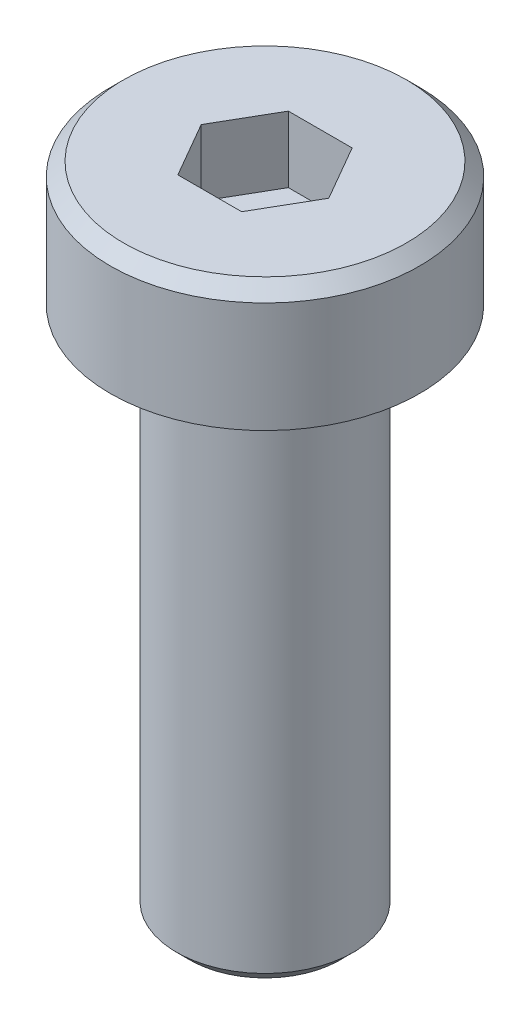
from build123d import *

# Parameters (mm, degrees)
CUT_EXTRUDE_322_DEPTH = 1.5


with BuildPart() as part:
    # Sketch 184 → Revolve 223 (revolve)
    with BuildSketch(Plane.XY, mode=Mode.PRIVATE) as revolve_223_sk:
        Polygon((0, -12), (1.7, -12), (2, -11.7), (2, 0), (3.5, 0), (3.5, 2.5), (3.2, 2.8), (0, 2.8), align=None)
    revolve(revolve_223_sk.sketch.rotate(Axis((0, -14, 0), (0, 1, 0)), 90), axis=Axis((0, -14, 0), (0, 1, 0)))

    # Sketch 274 → Cut-Extrude 322 (cut)
    with BuildSketch(Plane(origin=(0, 2.8, 0), x_dir=(1, 0, 0), z_dir=(0, 1, 0))):
        Polygon((1.443375673, 0), (0.721687836, 1.25), (-0.721687836, 1.25), (-1.443375673, 0), (-0.721687836, -1.25), (0.721687836, -1.25), align=None)
    extrude(amount=-CUT_EXTRUDE_322_DEPTH, mode=Mode.SUBTRACT)


solid = part.part
